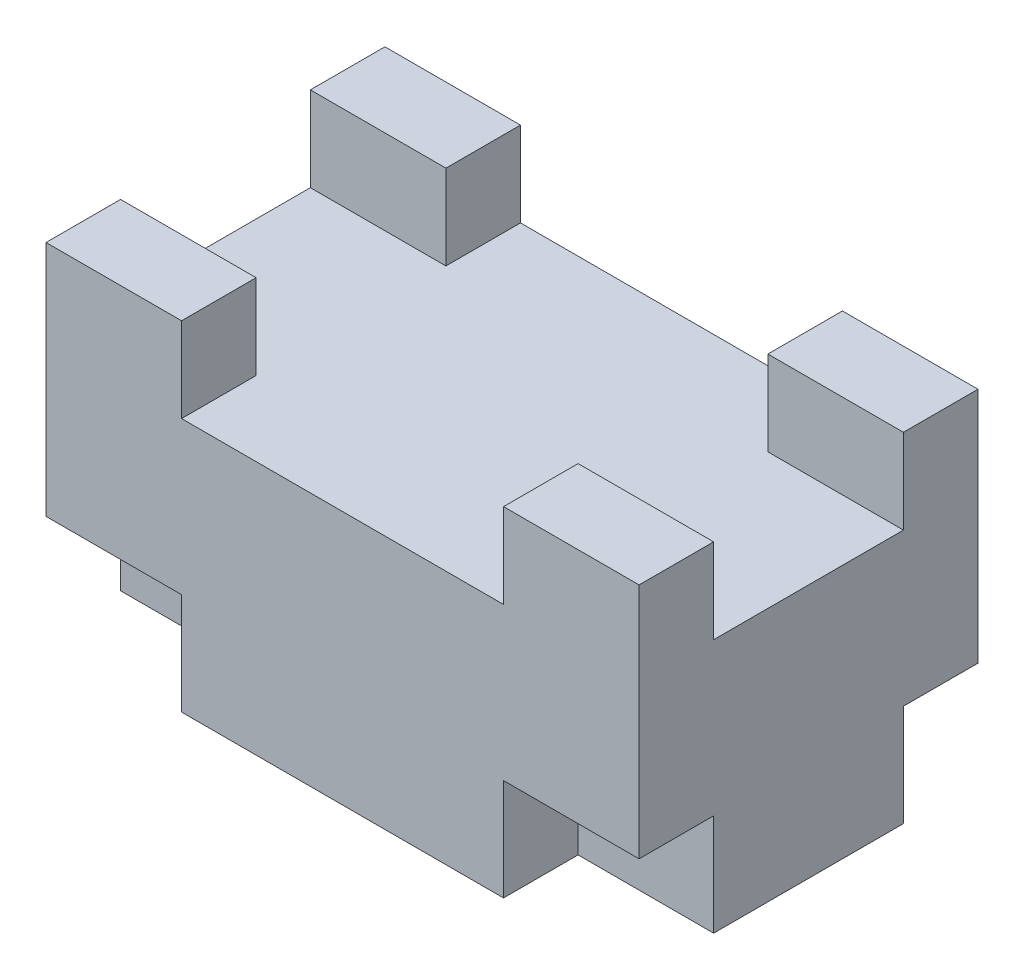
from build123d import *

# Parameters (mm, degrees)
SKETCH2_W           = 175
SKETCH2_H           = 100
BOSS_EXTRUDE1_DEPTH = 75
SKETCH3_W           = 40
SKETCH3_H           = 22
CUT_EXTRUDE1_DEPTH  = 30
SKETCH4_W           = 40
SKETCH4_H           = 22
BOSS_EXTRUDE2_DEPTH = 25


with BuildPart() as part:
    # Sketch2 → Boss-Extrude1 (new body)
    with BuildSketch(Plane(origin=(0, 0, 0), x_dir=(1, 0, 0), z_dir=(0, 1, 0))):
        Rectangle(SKETCH2_W, SKETCH2_H)
    extrude(amount=BOSS_EXTRUDE1_DEPTH)

    # Sketch3 → Cut-Extrude1 (cut)
    with BuildSketch(Plane.XZ):
        with Locations((-67.5, 39)):
            Rectangle(SKETCH3_W, SKETCH3_H)
        with Locations((67.5, 39)):
            Rectangle(SKETCH3_W, SKETCH3_H)
        with Locations((-67.5, -39)):
            Rectangle(SKETCH3_W, SKETCH3_H)
        with Locations((67.5, -39)):
            Rectangle(SKETCH3_W, SKETCH3_H)
    extrude(amount=-CUT_EXTRUDE1_DEPTH, mode=Mode.SUBTRACT)

    # Sketch4 → Boss-Extrude2 (add)
    with BuildSketch(Plane(origin=(0, 75, 0), x_dir=(1, 0, 0), z_dir=(0, 1, 0))):
        with Locations((-67.5, 39)):
            Rectangle(SKETCH4_W, SKETCH4_H)
        with Locations((67.5, 39)):
            Rectangle(SKETCH4_W, SKETCH4_H)
        with Locations((67.5, -39)):
            Rectangle(SKETCH4_W, SKETCH4_H)
        with Locations((-67.5, -39)):
            Rectangle(SKETCH4_W, SKETCH4_H)
    extrude(amount=BOSS_EXTRUDE2_DEPTH)


solid = part.part
